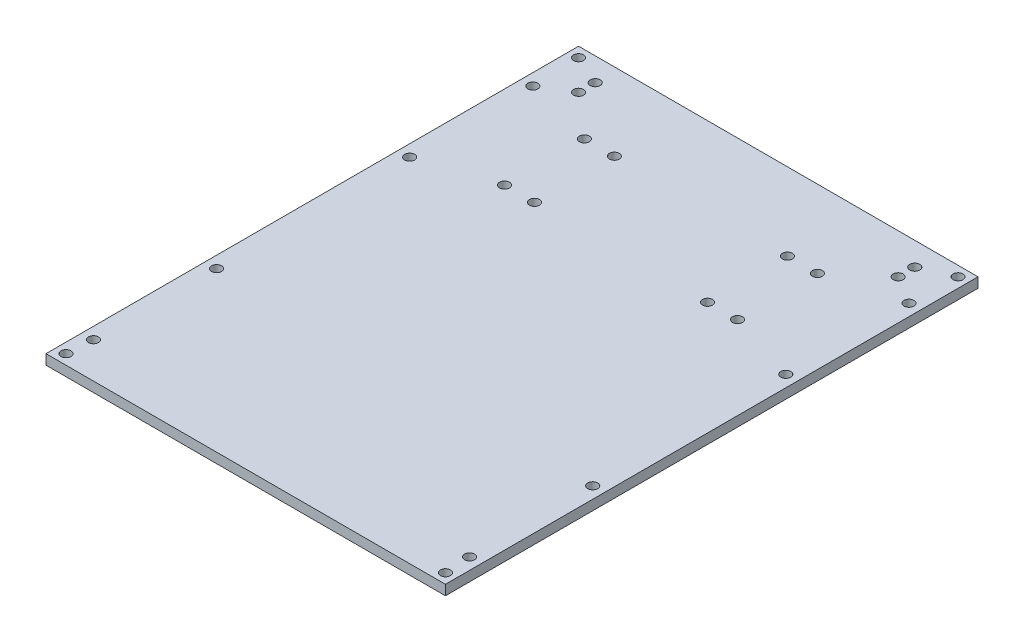
from build123d import *

# Parameters (mm, degrees)
SKETCH1_W           = 120
SKETCH1_H           = 160
BOSS_EXTRUDE1_DEPTH = 3
SKETCH2_R           = 1.5
CUT_EXTRUDE12_DEPTH = 3
SKETCH3_R           = 1.5
CUT_EXTRUDE13_DEPTH = 10


with BuildPart() as part:
    # Sketch1 → Boss-Extrude1 (new body)
    with BuildSketch(Plane(origin=(0, 0, 0), x_dir=(1, 0, 0), z_dir=(0, 1, 0))):
        with Locations((-60, 80)):
            Rectangle(SKETCH1_W, SKETCH1_H)
    extrude(amount=BOSS_EXTRUDE1_DEPTH)

    # Sketch2 → Cut-Extrude12 (cut)
    with BuildSketch(Plane(origin=(0, 3, 0), x_dir=(1, 0, 0), z_dir=(0, 1, 0))):
        with Locations(Location((-25, 112.75, 0), (0, 0, 270))):
            Circle(SKETCH2_R)
        with Locations(Location((-3.5, 105.75, 0), (0, 0, 270))):
            Circle(SKETCH2_R)
        with Locations(Location((-34, 136.75, 0), (0, 0, 270))):
            Circle(SKETCH2_R)
        with Locations(Location((-25, 136.75, 0), (0, 0, 270))):
            Circle(SKETCH2_R)
        with Locations(Location((-34, 112.75, 0), (0, 0, 270))):
            Circle(SKETCH2_R)
        with Locations(Location((-3.5, 142.75, 0), (0, 0, 270))):
            Circle(SKETCH2_R)
        with Locations(Location((-12, 148, 0), (0, 0, 270))):
            Circle(SKETCH2_R)
        with Locations(Location((-12, 153, 0), (0, 0, 270))):
            Circle(SKETCH2_R)
        with Locations(Location((-108, 153, 0), (0, 0, 90))):
            Circle(SKETCH2_R)
        with Locations(Location((-108, 148, 0), (0, 0, 90))):
            Circle(SKETCH2_R)
        with Locations(Location((-116.5, 142.75, 0), (0, 0, 90))):
            Circle(SKETCH2_R)
        with Locations(Location((-95, 136.75, 0), (0, 0, 90))):
            Circle(SKETCH2_R)
        with Locations(Location((-86, 136.75, 0), (0, 0, 90))):
            Circle(SKETCH2_R)
        with Locations(Location((-86, 112.75, 0), (0, 0, 90))):
            Circle(SKETCH2_R)
        with Locations(Location((-95, 112.75, 0), (0, 0, 90))):
            Circle(SKETCH2_R)
        with Locations(Location((-116.5, 105.75, 0), (0, 0, 90))):
            Circle(SKETCH2_R)
        with Locations(Location((-3.5, 47.75, 0), (0, 0, 270))):
            Circle(SKETCH2_R)
        with Locations(Location((-3.5, 10.75, 0), (0, 0, 270))):
            Circle(SKETCH2_R)
        with Locations(Location((-116.5, 47.75, 0), (0, 0, 90))):
            Circle(SKETCH2_R)
        with Locations(Location((-116.5, 10.75, 0), (0, 0, 90))):
            Circle(SKETCH2_R)
    extrude(amount=-CUT_EXTRUDE12_DEPTH, mode=Mode.SUBTRACT)

    # Sketch3 → Cut-Extrude13 (cut)
    with BuildSketch(Plane(origin=(0, 3, 0), x_dir=(1, 0, 0), z_dir=(0, 1, 0))):
        with Locations(Location((-117, 157, 0), (0, 0, 270))):
            Circle(SKETCH3_R)
        with Locations(Location((-3, 157, 0), (0, 0, 270))):
            Circle(SKETCH3_R)
        with Locations(Location((-117, 3, 0), (0, 0, 270))):
            Circle(SKETCH3_R)
        with Locations(Location((-3, 3, 0), (0, 0, 270))):
            Circle(SKETCH3_R)
    extrude(amount=-CUT_EXTRUDE13_DEPTH, mode=Mode.SUBTRACT)


solid = part.part
